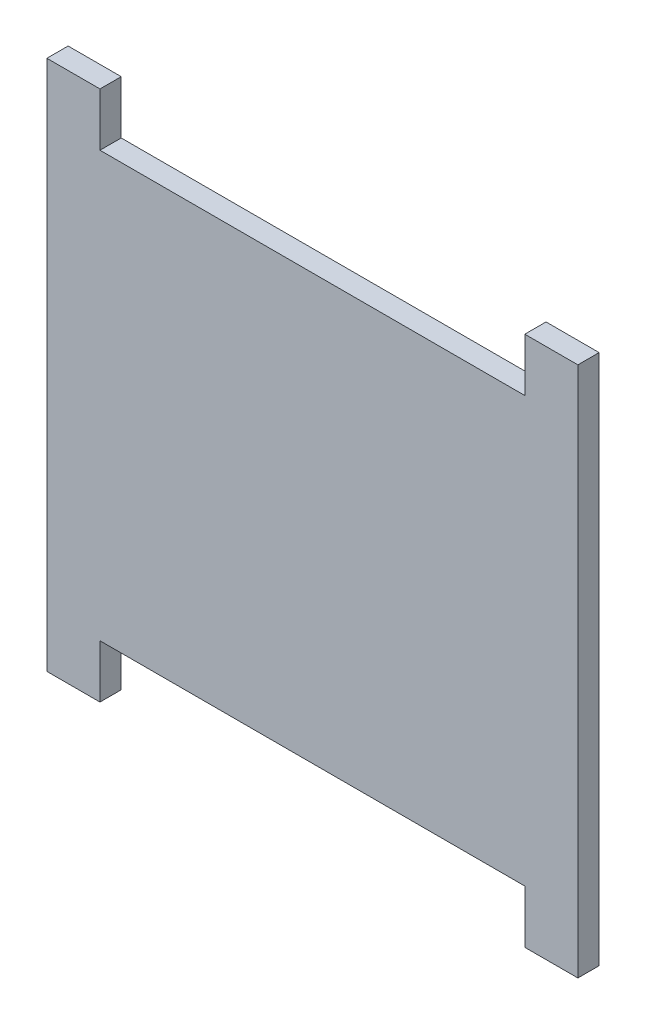
from build123d import *

# Parameters (mm, degrees)
EXTRUDE_1_DEPTH = 2


with BuildPart() as part:
    # 草图1 → 凸台-拉伸1 (new body)
    with BuildSketch(Plane.XY):
        Polygon((0, 0), (40, 0), (40, -5), (45, -5), (45, 45), (40, 45), (40, 40), (0, 40), (0, 45), (-5, 45), (-5, -5), (0, -5), align=None)
    extrude(amount=EXTRUDE_1_DEPTH)


solid = part.part
